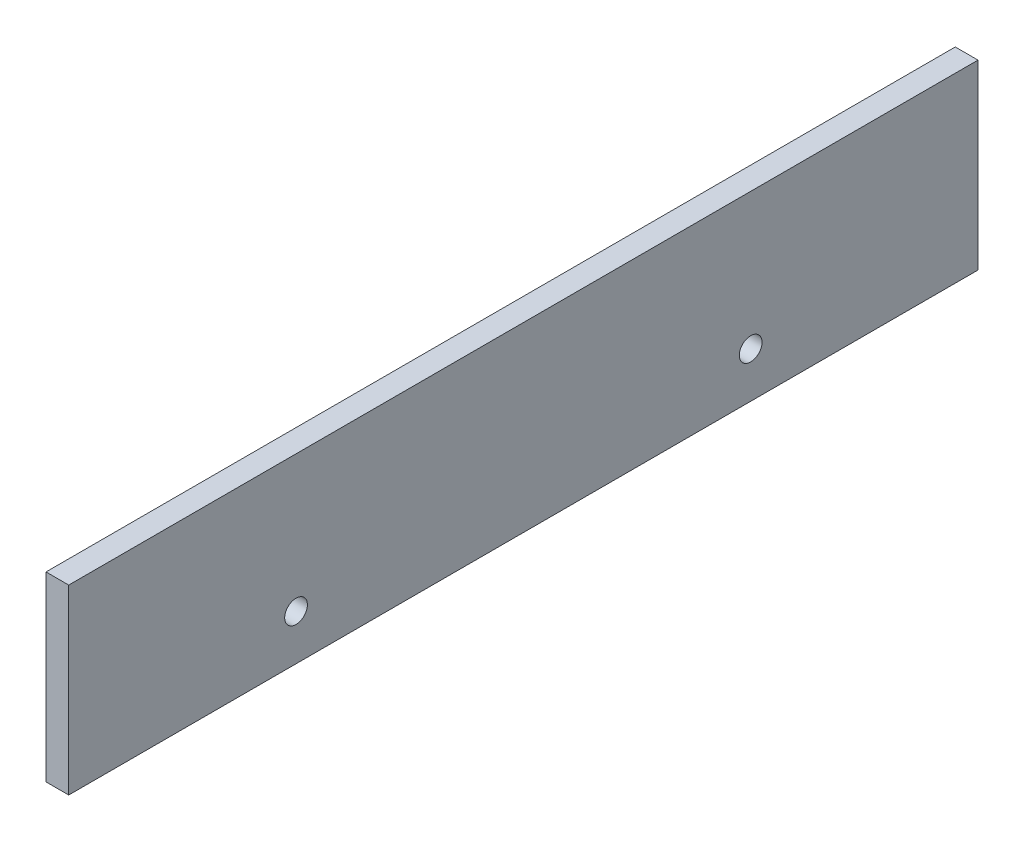
from build123d import *

# Parameters (mm, degrees)
SKETCH_1_W          = 5
SKETCH_1_H          = 40
EXTRUDE_1_DEPTH     = 200
SKETCH_2_R          = 2.5
CUT_EXTRUDE_1_DEPTH = 202.059692629


with BuildPart() as part:
    # 草图1 → 凸台-拉伸1 (new body)
    with BuildSketch(Plane.XY):
        Rectangle(SKETCH_1_W, SKETCH_1_H)
    extrude(amount=EXTRUDE_1_DEPTH)

    # 草图2 → 切除-拉伸1 (cut, through all)
    with BuildSketch(Plane(origin=(2.5, 0, 0), x_dir=(0, 0, -1), z_dir=(1, 0, 0))):
        with Locations(Location((-150, -10, 0), (0, 0, 90))):
            Circle(SKETCH_2_R)
        with Locations(Location((-50, -10, 0), (0, 0, 90))):
            Circle(SKETCH_2_R)
    extrude(amount=-CUT_EXTRUDE_1_DEPTH, mode=Mode.SUBTRACT)


solid = part.part
